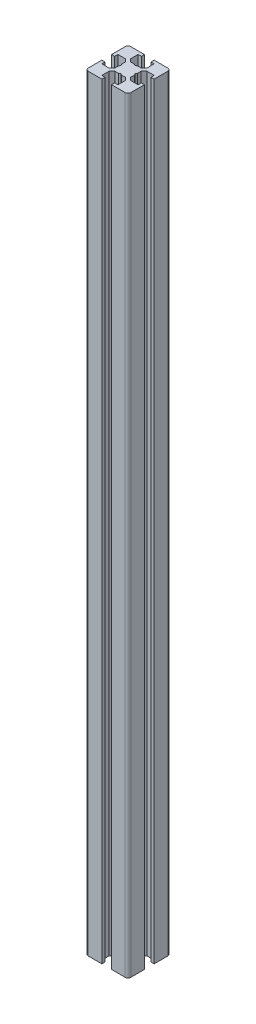
from build123d import *

# Parameters (mm, degrees)
BOSS_EXTRUDE1_DEPTH = 270


with BuildPart() as part:
    # Sketch2 → Boss-Extrude1 (new body)
    with BuildSketch(Plane(origin=(0, 0, 0), x_dir=(1, 0, 0), z_dir=(0, 1, 0))):
        with BuildLine():
            Line((1.7, 7.5), (6.5, 7.5))
            ThreePointArc((6.5, 7.5), (7.207106781, 7.207106781), (7.5, 6.5))
            Line((7.5, 6.5), (7.5, 1.7))
            Line((7.5, 1.7), (6.4, 1.7))
            Line((6.4, 1.7), (6.4, 2.85))
            Line((6.4, 2.85), (3.8, 2.85))
            Line((3.8, 2.85), (2.8, 1.85))
            Line((2.8, 1.85), (2.8, 0.519615242))
            Line((2.8, 0.519615242), (2.5, 0))
            Line((2.5, 0), (2.8, -0.519615242))
            Line((2.8, -0.519615242), (2.8, -1.85))
            Line((2.8, -1.85), (3.8, -2.85))
            Line((3.8, -2.85), (6.4, -2.85))
            Line((6.4, -2.85), (6.4, -1.7))
            Line((6.4, -1.7), (7.5, -1.7))
            Line((7.5, -1.7), (7.5, -6.5))
            ThreePointArc((7.5, -6.5), (7.207106781, -7.207106781), (6.5, -7.5))
            Line((6.5, -7.5), (1.7, -7.5))
            Line((1.7, -7.5), (1.7, -6.4))
            Line((1.7, -6.4), (2.85, -6.4))
            Line((2.85, -6.4), (2.85, -3.8))
            Line((2.85, -3.8), (1.85, -2.8))
            Line((1.85, -2.8), (0.519615242, -2.8))
            Line((0.519615242, -2.8), (0, -2.5))
            Line((0, -2.5), (-0.519615242, -2.8))
            Line((-0.519615242, -2.8), (-1.85, -2.8))
            Line((-1.85, -2.8), (-2.85, -3.8))
            Line((-2.85, -3.8), (-2.85, -6.4))
            Line((-2.85, -6.4), (-1.7, -6.4))
            Line((-1.7, -6.4), (-1.7, -7.5))
            Line((-1.7, -7.5), (-6.5, -7.5))
            ThreePointArc((-6.5, -7.5), (-7.207106781, -7.207106781), (-7.5, -6.5))
            Line((-7.5, -6.5), (-7.5, -1.7))
            Line((-7.5, -1.7), (-6.4, -1.7))
            Line((-6.4, -1.7), (-6.4, -2.85))
            Line((-6.4, -2.85), (-3.8, -2.85))
            Line((-3.8, -2.85), (-2.8, -1.85))
            Line((-2.8, -1.85), (-2.8, -0.519615242))
            Line((-2.8, -0.519615242), (-2.5, 0))
            Line((-2.5, 0), (-2.8, 0.519615242))
            Line((-2.8, 0.519615242), (-2.8, 1.85))
            Line((-2.8, 1.85), (-3.8, 2.85))
            Line((-3.8, 2.85), (-6.4, 2.85))
            Line((-6.4, 2.85), (-6.4, 1.7))
            Line((-6.4, 1.7), (-7.5, 1.7))
            Line((-7.5, 1.7), (-7.5, 6.5))
            ThreePointArc((-7.5, 6.5), (-7.207106781, 7.207106781), (-6.5, 7.5))
            Line((-6.5, 7.5), (-1.7, 7.5))
            Line((-1.7, 7.5), (-1.7, 6.4))
            Line((-1.7, 6.4), (-2.85, 6.4))
            Line((-2.85, 6.4), (-2.85, 3.8))
            Line((-2.85, 3.8), (-1.85, 2.8))
            Line((-1.85, 2.8), (-0.519615242, 2.8))
            Line((-0.519615242, 2.8), (0, 2.5))
            Line((0, 2.5), (0.519615242, 2.8))
            Line((0.519615242, 2.8), (1.85, 2.8))
            Line((1.85, 2.8), (2.85, 3.8))
            Line((2.85, 3.8), (2.85, 6.4))
            Line((2.85, 6.4), (1.7, 6.4))
            Line((1.7, 6.4), (1.7, 7.5))
        make_face()
    extrude(amount=BOSS_EXTRUDE1_DEPTH)


solid = part.part
